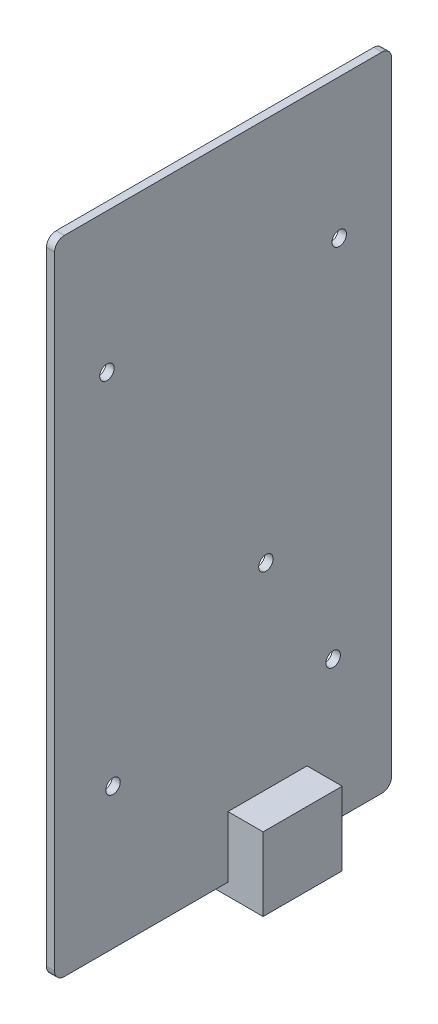
from build123d import *

# Parameters (mm, degrees)
SKETCH1_R                = 1.5
BOSS_EXTRUDE2_DEPTH      = 1.7
BOSS_EXTRUDE3_DEPTH      = 7.3
BOSS_EXTRUDE3_DEPTH_BACK = 4.1
SKETCH2_W                = 16.43
SKETCH2_H                = 15.24


with BuildPart() as part:
    # Sketch1 → Boss-Extrude2 (new body)
    with BuildSketch(Plane(origin=(0, 0, 0), x_dir=(0, 0, -1), z_dir=(1, 0, 0))):
        with BuildLine():
            Line((-33, 66.67), (33, 66.67))
            ThreePointArc((33, 66.67), (34.414213562, 66.084213562), (35, 64.67))
            Line((35, 64.67), (35, -64.67))
            ThreePointArc((35, -64.67), (34.414213562, -66.084213562), (33, -66.67))
            Line((33, -66.67), (-33, -66.67))
            ThreePointArc((-33, -66.67), (-34.414213562, -66.084213562), (-35, -64.67))
            Line((-35, -64.67), (-35, 64.67))
            ThreePointArc((-35, 64.67), (-34.414213562, 66.084213562), (-33, 66.67))
        make_face()
        with Locations((-22.86, -37.46)):
            Circle(SKETCH1_R, mode=Mode.SUBTRACT)
        with Locations((22.86, -37.46)):
            Circle(SKETCH1_R, mode=Mode.SUBTRACT)
        with Locations((-24.13, 37.63)):
            Circle(SKETCH1_R, mode=Mode.SUBTRACT)
        with Locations((24.13, 37.63)):
            Circle(SKETCH1_R, mode=Mode.SUBTRACT)
        with Locations((8.89, -13.17)):
            Circle(SKETCH1_R, mode=Mode.SUBTRACT)
    extrude(amount=BOSS_EXTRUDE2_DEPTH)

    # Sketch2 → Boss-Extrude3 (add, two sides: drawn at the far end of the back side and taken through both)
    with BuildSketch(Plane(origin=(1.7, 0, 0), x_dir=(0, 0, -1), z_dir=(1, 0, 0)).offset(-BOSS_EXTRUDE3_DEPTH_BACK)):
        with Locations((9.225, -61.59)):
            Rectangle(SKETCH2_W, SKETCH2_H)
    extrude(amount=BOSS_EXTRUDE3_DEPTH + BOSS_EXTRUDE3_DEPTH_BACK)


solid = part.part
